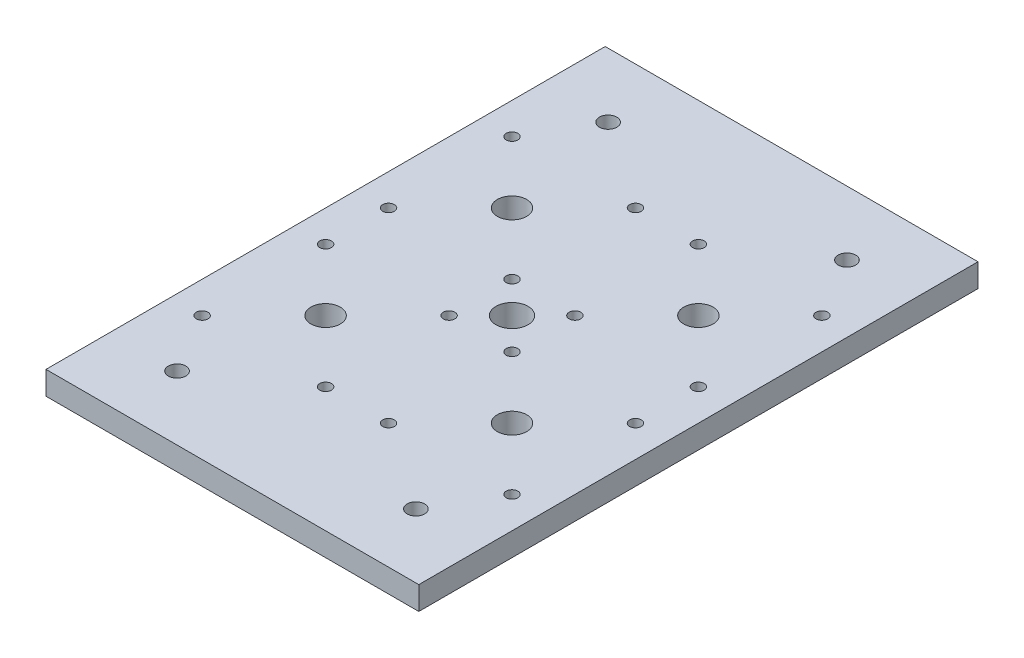
from build123d import *

# Parameters (mm, degrees)
SKETCH1_W           = 101.6
SKETCH1_H           = 152.4
SKETCH1_R           = 4
SKETCH1_R_2         = 1.5875
SKETCH1_R_3         = 4.365625
SKETCH1_R_4         = 2.38125
BOSS_EXTRUDE1_DEPTH = 6.35


with BuildPart() as part:
    # Sketch1 → Boss-Extrude1 (new body)
    with BuildSketch(Plane(origin=(0, 0, 0), x_dir=(1, 0, 0), z_dir=(0, 1, 0))):
        Rectangle(SKETCH1_W, SKETCH1_H)
        with Locations(Location((-25.4, 25.4, 0), (0, 0, 270))):
            Circle(SKETCH1_R, mode=Mode.SUBTRACT)
        with Locations(Location((-42.225, 42.225, 0), (0, 0, 270))):
            Circle(SKETCH1_R_2, mode=Mode.SUBTRACT)
        with Locations(Location((-8.575, 42.225, 0), (0, 0, 90))):
            Circle(SKETCH1_R_2, mode=Mode.SUBTRACT)
        with Locations(Location((-8.575, 8.575, 0), (0, 0, 270))):
            Circle(SKETCH1_R_2, mode=Mode.SUBTRACT)
        with Locations(Location((-42.225, 8.575, 0), (0, 0, 90))):
            Circle(SKETCH1_R_2, mode=Mode.SUBTRACT)
        with Locations(Location((8.575, 8.575, 0), (0, 0, 90))):
            Circle(SKETCH1_R_2, mode=Mode.SUBTRACT)
        with Locations(Location((42.225, 8.575, 0), (0, 0, 270))):
            Circle(SKETCH1_R_2, mode=Mode.SUBTRACT)
        with Locations(Location((42.225, 42.225, 0), (0, 0, 90))):
            Circle(SKETCH1_R_2, mode=Mode.SUBTRACT)
        with Locations(Location((8.575, 42.225, 0), (0, 0, 270))):
            Circle(SKETCH1_R_2, mode=Mode.SUBTRACT)
        with Locations(Location((25.4, 25.4, 0), (0, 0, 90))):
            Circle(SKETCH1_R, mode=Mode.SUBTRACT)
        with Locations(Location((42.225, -8.575, 0), (0, 0, 90))):
            Circle(SKETCH1_R_2, mode=Mode.SUBTRACT)
        with Locations(Location((42.225, -42.225, 0), (0, 0, 270))):
            Circle(SKETCH1_R_2, mode=Mode.SUBTRACT)
        with Locations(Location((8.575, -42.225, 0), (0, 0, 90))):
            Circle(SKETCH1_R_2, mode=Mode.SUBTRACT)
        with Locations(Location((25.4, -25.4, 0), (0, 0, 270))):
            Circle(SKETCH1_R, mode=Mode.SUBTRACT)
        with Locations(Location((8.575, -8.575, 0), (0, 0, 270))):
            Circle(SKETCH1_R_2, mode=Mode.SUBTRACT)
        with Locations(Location((-8.575, -8.575, 0), (0, 0, 90))):
            Circle(SKETCH1_R_2, mode=Mode.SUBTRACT)
        with Locations(Location((-42.225, -8.575, 0), (0, 0, 270))):
            Circle(SKETCH1_R_2, mode=Mode.SUBTRACT)
        with Locations(Location((-8.575, -42.225, 0), (0, 0, 270))):
            Circle(SKETCH1_R_2, mode=Mode.SUBTRACT)
        with Locations(Location((-25.4, -25.4, 0), (0, 0, 90))):
            Circle(SKETCH1_R, mode=Mode.SUBTRACT)
        with Locations(Location((-42.225, -42.225, 0), (0, 0, 90))):
            Circle(SKETCH1_R_2, mode=Mode.SUBTRACT)
        with Locations(Location((0, 0, 0), (0, 0, 270))):
            Circle(SKETCH1_R_3, mode=Mode.SUBTRACT)
        with Locations(Location((32.54375, 58.7375, 0), (0, 0, 270))):
            Circle(SKETCH1_R_4, mode=Mode.SUBTRACT)
        with Locations(Location((32.54375, -58.7375, 0), (0, 0, 90))):
            Circle(SKETCH1_R_4, mode=Mode.SUBTRACT)
        with Locations(Location((-32.54375, -58.7375, 0), (0, 0, 270))):
            Circle(SKETCH1_R_4, mode=Mode.SUBTRACT)
        with Locations(Location((-32.54375, 58.7375, 0), (0, 0, 90))):
            Circle(SKETCH1_R_4, mode=Mode.SUBTRACT)
    extrude(amount=BOSS_EXTRUDE1_DEPTH)


solid = part.part
